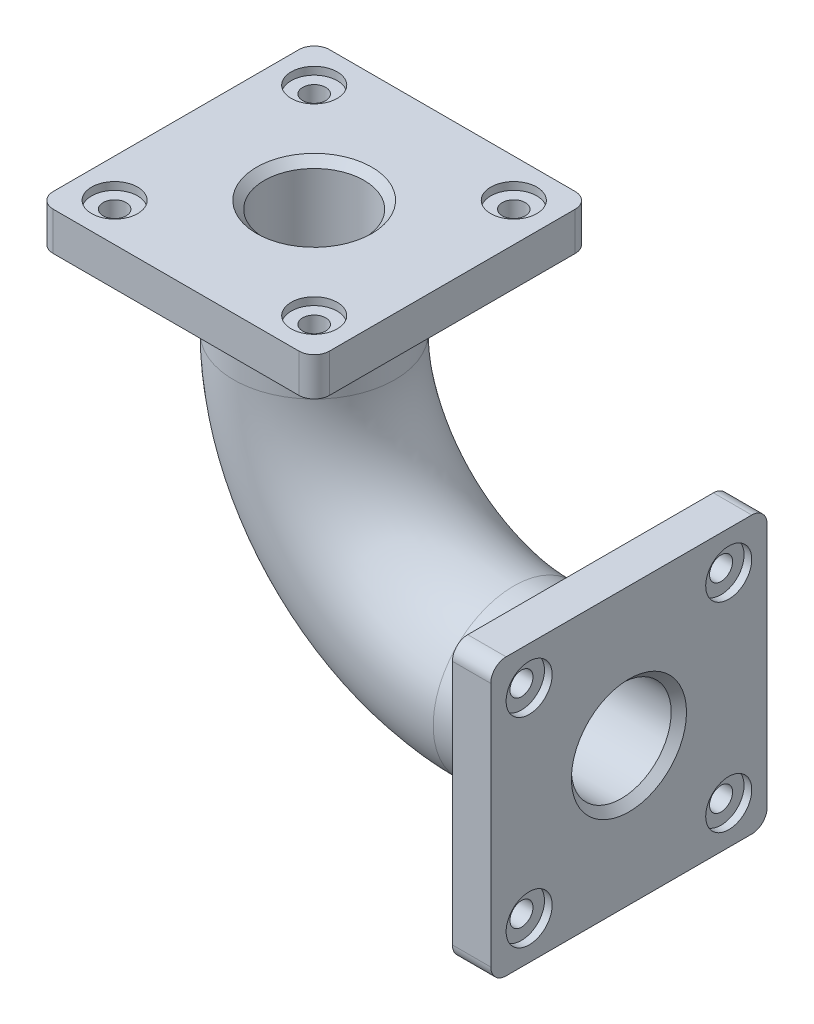
from build123d import *

# Parameters (mm, degrees)
SKETCH2_R           = 105
SKETCH2_R_2         = 65
BOSS_EXTRUDE1_START = -50
SKETCH4_W           = 360
SKETCH4_H           = 360
SKETCH4_R           = 105
BOSS_EXTRUDE1_DEPTH = 50
FILLET1_R           = 20
SKETCH5_R           = 105
BOSS_EXTRUDE2_DEPTH = 50
SKETCH6_R           = 30
CUT_EXTRUDE1_DEPTH  = 10
CUT_EXTRUDE2_REACH  = 848.699
SKETCH7_R           = 15
CIRPATTERN1_COUNT   = 4
SKETCH8_R           = 30
CUT_EXTRUDE4_DEPTH  = 10
CUT_EXTRUDE5_REACH  = 734.735
SKETCH10_R          = 15
CIRPATTERN2_COUNT   = 4
CHAMFER1_SIZE       = 10


with BuildPart() as part:
    # Sweep-Thin1: sweep along a path in Sketch1
    with BuildLine(Plane.XY) as sweep_thin1_path:
        Line((0, 0), (-150, 0))
        ThreePointArc((-150, 0), (-333.847763109, 76.152236891), (-410, 260))
        Line((-410, 260), (-410, 410))
    # Sketch2 → Sweep-Thin1 (sweep)
    with BuildSketch(Plane(origin=(0, 0, 0), x_dir=(0, 0, -1), z_dir=(1, 0, 0))):
        Circle(SKETCH2_R)
        Circle(SKETCH2_R_2, mode=Mode.SUBTRACT)
    sweep(path=sweep_thin1_path.line)

    # Sketch4 → Boss-Extrude1 (add)
    with BuildSketch(Plane(origin=(0, 0, 0), x_dir=(0, 0, -1), z_dir=(1, 0, 0)).offset(BOSS_EXTRUDE1_START)):
        Rectangle(SKETCH4_W, SKETCH4_H)
        with Locations(Location((0, 0, 0), (0, 0, 270))):
            Circle(SKETCH4_R, mode=Mode.SUBTRACT)
    extrude(amount=BOSS_EXTRUDE1_DEPTH)

    # Fillet1
    fillet1_edges = [part.edges().sort_by_distance(p)[0] for p in [
        (-25, 180, -180),
        (-25, -180, -180),
        (-25, -180, 180),
        (-25, 180, 180),
    ]]
    fillet(fillet1_edges, radius=FILLET1_R)

    # Sketch5 → Boss-Extrude2 (add)
    with BuildSketch(Plane(origin=(0, 410, 0), x_dir=(1, 0, 0), z_dir=(0, 1, 0))):
        with BuildLine():
            Line((-570, -180), (-250, -180))
            ThreePointArc((-250, -180), (-235.857864376, -174.142135624), (-230, -160))
            Line((-230, -160), (-230, 160))
            ThreePointArc((-230, 160), (-235.857864376, 174.142135624), (-250, 180))
            Line((-250, 180), (-570, 180))
            ThreePointArc((-570, 180), (-584.142135624, 174.142135624), (-590, 160))
            Line((-590, 160), (-590, -160))
            ThreePointArc((-590, -160), (-584.142135624, -174.142135624), (-570, -180))
        make_face()
        with Locations(Location((-410, 0, 0), (0, 0, 180))):
            Circle(SKETCH5_R, mode=Mode.SUBTRACT)
    extrude(amount=-BOSS_EXTRUDE2_DEPTH)

    # Sketch6 → Cut-Extrude1 (cut)
    with BuildSketch(Plane(origin=(0, 410, 0), x_dir=(1, 0, 0), z_dir=(0, 1, 0))):
        with Locations(Location((-540, 130, 0), (0, 0, 180))):
            Circle(SKETCH6_R)
    cut_extrude1 = extrude(amount=-CUT_EXTRUDE1_DEPTH, mode=Mode.SUBTRACT)

    # Sketch7 → Cut-Extrude2 (cut, up to next)
    with BuildSketch(Plane(origin=(0, 400, 0), x_dir=(1, 0, 0), z_dir=(0, 1, 0)), mode=Mode.PRIVATE) as cut_extrude2_sk1:
        with Locations(Location((-540, 130, 0), (0, 0, 180))):
            Circle(SKETCH7_R)
    cut_extrude2_tool1 = extrude(cut_extrude2_sk1.sketch, amount=-CUT_EXTRUDE2_REACH, mode=Mode.PRIVATE) & part.part
    cut_extrude2 = cut_extrude2_tool1.solids().sort_by_distance((-540, 400, -130))[0]
    add(cut_extrude2, mode=Mode.SUBTRACT)

    # CirPattern1: Cut-Extrude1, Cut-Extrude2 ×4 about axis
    cirpattern1_axis = Axis((-410, 0, 0), (0, 1, 0))
    add([cut_extrude1.rotate(cirpattern1_axis, i * 360 / CIRPATTERN1_COUNT) for i in range(1, CIRPATTERN1_COUNT)], mode=Mode.SUBTRACT)
    add([cut_extrude2.rotate(cirpattern1_axis, i * 360 / CIRPATTERN1_COUNT) for i in range(1, CIRPATTERN1_COUNT)], mode=Mode.SUBTRACT)

    # Sketch8 → Cut-Extrude4 (cut)
    with BuildSketch(Plane(origin=(0, 0, 0), x_dir=(0, 0, -1), z_dir=(1, 0, 0))):
        with Locations((-130, 130)):
            Circle(SKETCH8_R)
    cut_extrude4 = extrude(amount=-CUT_EXTRUDE4_DEPTH, mode=Mode.SUBTRACT)

    # Sketch10 → Cut-Extrude5 (cut, up to next)
    with BuildSketch(Plane(origin=(-10, 0, 0), x_dir=(0, 0, -1), z_dir=(1, 0, 0)), mode=Mode.PRIVATE) as cut_extrude5_sk1:
        with Locations((-130, 130)):
            Circle(SKETCH10_R)
    cut_extrude5_tool1 = extrude(cut_extrude5_sk1.sketch, amount=-CUT_EXTRUDE5_REACH, mode=Mode.PRIVATE) & part.part
    cut_extrude5 = cut_extrude5_tool1.solids().sort_by_distance((-10, 130, 130))[0]
    add(cut_extrude5, mode=Mode.SUBTRACT)

    # CirPattern2: Cut-Extrude4, Cut-Extrude5 ×4 about axis
    cirpattern2_axis = Axis((0, 0, 0), (1, 0, 0))
    add([cut_extrude4.rotate(cirpattern2_axis, i * 360 / CIRPATTERN2_COUNT) for i in range(1, CIRPATTERN2_COUNT)], mode=Mode.SUBTRACT)
    add([cut_extrude5.rotate(cirpattern2_axis, i * 360 / CIRPATTERN2_COUNT) for i in range(1, CIRPATTERN2_COUNT)], mode=Mode.SUBTRACT)

    # Chamfer1
    chamfer1_edges = [part.edges().sort_by_distance(p)[0] for p in [
        (0, 0, 65),
        (-410, 410, 65),
    ]]
    chamfer(chamfer1_edges, length=CHAMFER1_SIZE)


solid = part.part
